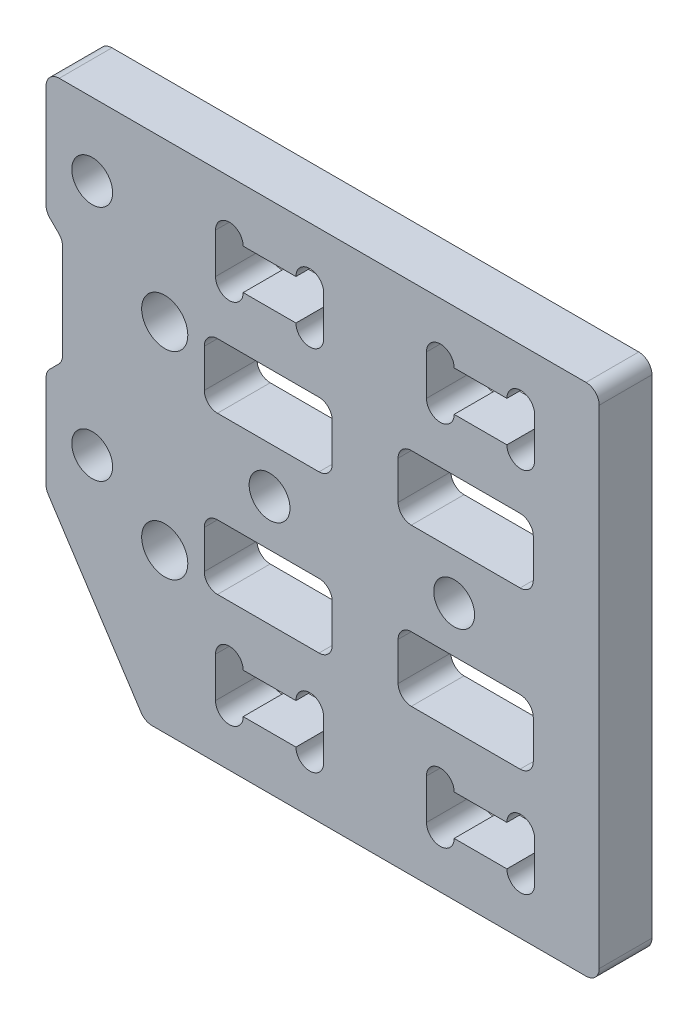
from build123d import *

# Parameters (mm, degrees)
SKETCH_1_R      = 1.75
SKETCH_1_R_2    = 1.55
SKETCH_1_W      = 10.25
SKETCH_1_H      = 4.9
EXTRUDE_1_DEPTH = 4
FILLET_1_R      = 1


with BuildPart() as part:
    # 草图1 → 凸台-拉伸1 (new body)
    with BuildSketch(Plane.XY):
        Polygon((-17.225, -19.5), (17.225, -19.5), (17.225, 19.5), (-14.225, 19.5), (-24.725, 19.5), (-24.725, 10.25), (-23.475, 9), (-23.475, 1), (-24.725, -0.25), (-24.725, -8), align=None)
        with BuildLine():
            Line((-5.775, -15.45), (-9.775, -15.45))
            ThreePointArc((-9.775, -15.45), (-10.825, -16.5), (-11.875, -15.45))
            Line((-11.875, -15.45), (-11.875, -12.4))
            ThreePointArc((-11.875, -12.4), (-10.825, -11.35), (-9.775, -12.4))
            Line((-9.775, -12.4), (-5.775, -12.4))
            ThreePointArc((-5.775, -12.4), (-4.725, -11.35), (-3.675, -12.4))
            Line((-3.675, -12.4), (-3.675, -15.45))
            ThreePointArc((-3.675, -15.45), (-4.725, -16.5), (-5.775, -15.45))
        make_face(mode=Mode.SUBTRACT)
        with Locations((-15.725, -7.5)):
            Circle(SKETCH_1_R, mode=Mode.SUBTRACT)
        with Locations((-21.225, -4)):
            Circle(SKETCH_1_R_2, mode=Mode.SUBTRACT)
        Polygon((-3.025, -8.4), (-12.225, -8.4), (-12.725, -8.4), (-12.725, -3.5), (-12.225, -3.5), (-3.025, -3.5), align=None, mode=Mode.SUBTRACT)
        with BuildLine():
            ThreePointArc((6.225, -15.45), (5.175, -16.5), (4.125, -15.45))
            Line((4.125, -15.45), (4.125, -12.4))
            ThreePointArc((4.125, -12.4), (5.175, -11.35), (6.225, -12.4))
            Line((6.225, -12.4), (10.225, -12.4))
            ThreePointArc((10.225, -12.4), (11.275, -11.35), (12.325, -12.4))
            Line((12.325, -12.4), (12.325, -15.45))
            ThreePointArc((12.325, -15.45), (11.275, -16.5), (10.225, -15.45))
            Line((10.225, -15.45), (6.225, -15.45))
        make_face(mode=Mode.SUBTRACT)
        with Locations((7.1, -5.95)):
            Rectangle(SKETCH_1_W, SKETCH_1_H, mode=Mode.SUBTRACT)
        with Locations((-15.725, 7.5)):
            Circle(SKETCH_1_R, mode=Mode.SUBTRACT)
        with Locations((-7.775, 0)):
            Circle(SKETCH_1_R_2, mode=Mode.SUBTRACT)
        Polygon((-12.225, 8.4), (-3.025, 8.4), (-3.025, 3.5), (-12.225, 3.5), (-12.725, 3.5), (-12.725, 8.4), align=None, mode=Mode.SUBTRACT)
        with Locations((-21.225, 14)):
            Circle(SKETCH_1_R_2, mode=Mode.SUBTRACT)
        with BuildLine():
            Line((-5.775, 12.4), (-9.775, 12.4))
            ThreePointArc((-9.775, 12.4), (-10.825, 11.35), (-11.875, 12.4))
            Line((-11.875, 12.4), (-11.875, 15.45))
            ThreePointArc((-11.875, 15.45), (-10.825, 16.5), (-9.775, 15.45))
            Line((-9.775, 15.45), (-5.775, 15.45))
            ThreePointArc((-5.775, 15.45), (-4.725, 16.5), (-3.675, 15.45))
            Line((-3.675, 15.45), (-3.675, 12.4))
            ThreePointArc((-3.675, 12.4), (-4.725, 11.35), (-5.775, 12.4))
        make_face(mode=Mode.SUBTRACT)
        with Locations((6.225, 0)):
            Circle(SKETCH_1_R_2, mode=Mode.SUBTRACT)
        with Locations((7.1, 5.95)):
            Rectangle(SKETCH_1_W, SKETCH_1_H, mode=Mode.SUBTRACT)
        with BuildLine():
            Line((10.225, 12.4), (6.225, 12.4))
            ThreePointArc((6.225, 12.4), (5.175, 11.35), (4.125, 12.4))
            Line((4.125, 12.4), (4.125, 15.45))
            ThreePointArc((4.125, 15.45), (5.175, 16.5), (6.225, 15.45))
            Line((6.225, 15.45), (10.225, 15.45))
            ThreePointArc((10.225, 15.45), (11.275, 16.5), (12.325, 15.45))
            Line((12.325, 15.45), (12.325, 12.4))
            ThreePointArc((12.325, 12.4), (11.275, 11.35), (10.225, 12.4))
        make_face(mode=Mode.SUBTRACT)
    extrude(amount=EXTRUDE_1_DEPTH)

    # 圆角1
    fillet_1_edges = [part.edges().sort_by_distance(p)[0] for p in [
        (-23.475, 1, 2),
        (-23.475, 9, 2),
        (-24.725, 10.25, 2),
        (-24.725, 19.5, 2),
        (17.225, 19.5, 2),
        (17.225, -19.5, 2),
        (-17.225, -19.5, 2),
        (-24.725, -8, 2),
        (-24.725, -0.25, 2),
        (-3.025, -8.4, 2),
        (-3.025, -3.5, 2),
        (-12.725, -3.5, 2),
        (-12.725, -8.4, 2),
        (-3.025, 3.5, 2),
        (-3.025, 8.4, 2),
        (-12.725, 8.4, 2),
        (-12.725, 3.5, 2),
        (12.225, 8.4, 2),
        (1.975, 8.4, 2),
        (1.975, 3.5, 2),
        (12.225, 3.5, 2),
        (1.975, -8.4, 2),
        (12.225, -8.4, 2),
        (12.225, -3.5, 2),
        (1.975, -3.5, 2),
    ]]
    fillet(fillet_1_edges, radius=FILLET_1_R)


solid = part.part
